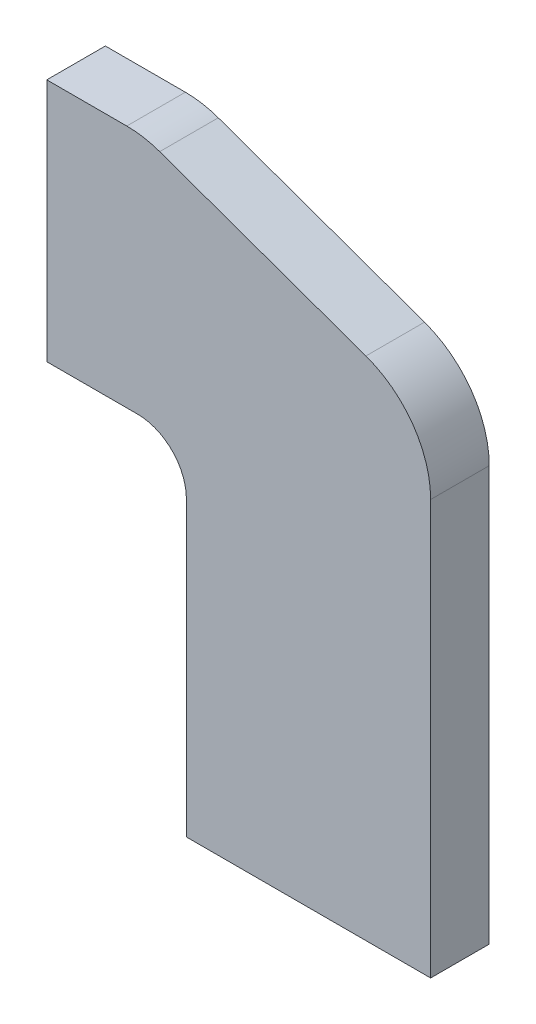
from build123d import *

# Parameters (mm, degrees)
SKETCH_1_W          = 78.62
SKETCH_1_H          = 50
EXTRUDE_1_DEPTH     = 12
SKETCH_3_W          = 50.02416134
SKETCH_3_H          = 10
CUT_EXTRUDE_1_DEPTH = 94.942026804
FILLET_3_R          = 20
FILLET_4_R          = 20
SKETCH_5_R          = 2.5
CUT_EXTRUDE_3_DEPTH = 20
SKETCH_6_W          = 50.02416134
SKETCH_6_H          = 80
EXTRUDE_2_DEPTH     = 12
FILLET_5_R          = 10
SKETCH_7_R          = 2.5
CUT_EXTRUDE_4_DEPTH = 30


with BuildPart() as part:
    # Эскиз1 → Бобышка-Вытянуть1 (new body)
    with BuildSketch(Plane.XY):
        with Locations((39.31, 25)):
            Rectangle(SKETCH_1_W, SKETCH_1_H)
    extrude(amount=EXTRUDE_1_DEPTH)

    # Эскиз3 → Вырез-Вытянуть1 (cut, through all)
    with BuildSketch(Plane.XY.offset(12)):
        Polygon((19.858926821, 50), (78.62, 28.952063791), (78.62, 50), align=None)
        with Locations((53.60791933, 5)):
            Rectangle(SKETCH_3_W, SKETCH_3_H)
    extrude(amount=-CUT_EXTRUDE_1_DEPTH, mode=Mode.SUBTRACT)

    # Скругление3
    fillet_3_edges = [part.edges().sort_by_distance(p)[0] for p in [
        (78.62, 28.952063791, 6),
    ]]
    fillet(fillet_3_edges, radius=FILLET_3_R)

    # Скругление4
    fillet_4_edges = [part.edges().sort_by_distance(p)[0] for p in [
        (19.858926821, 50, 6),
    ]]
    fillet(fillet_4_edges, radius=FILLET_4_R)

    # Эскиз5 → Вырез-Вытянуть3 (cut)
    with BuildSketch(Plane.ZY):
        with Locations(Location((6, 7, 0), (0, 0, 270))):
            Circle(SKETCH_5_R)
        with Locations(Location((6, 41, 0), (0, 0, 270))):
            Circle(SKETCH_5_R)
    extrude(amount=-CUT_EXTRUDE_3_DEPTH, mode=Mode.SUBTRACT)

    # Эскиз6 → Бобышка-Вытянуть2 (add)
    with BuildSketch(Plane.XY.offset(12)):
        with Locations((53.60791933, -30)):
            Rectangle(SKETCH_6_W, SKETCH_6_H)
    extrude(amount=-EXTRUDE_2_DEPTH)

    # Скругление5
    fillet_5_edges = [part.edges().sort_by_distance(p)[0] for p in [
        (28.59583866, 0, 6),
    ]]
    fillet(fillet_5_edges, radius=FILLET_5_R)

    # Эскиз7 → Вырез-Вытянуть4 (cut)
    with BuildSketch(Plane.XZ.offset(70)):
        with Locations(Location((38.59583866, 6, 0), (0, 0, 270))):
            Circle(SKETCH_7_R)
        with Locations(Location((68.59583866, 6, 0), (0, 0, 270))):
            Circle(SKETCH_7_R)
    extrude(amount=-CUT_EXTRUDE_4_DEPTH, mode=Mode.SUBTRACT)


solid = part.part
